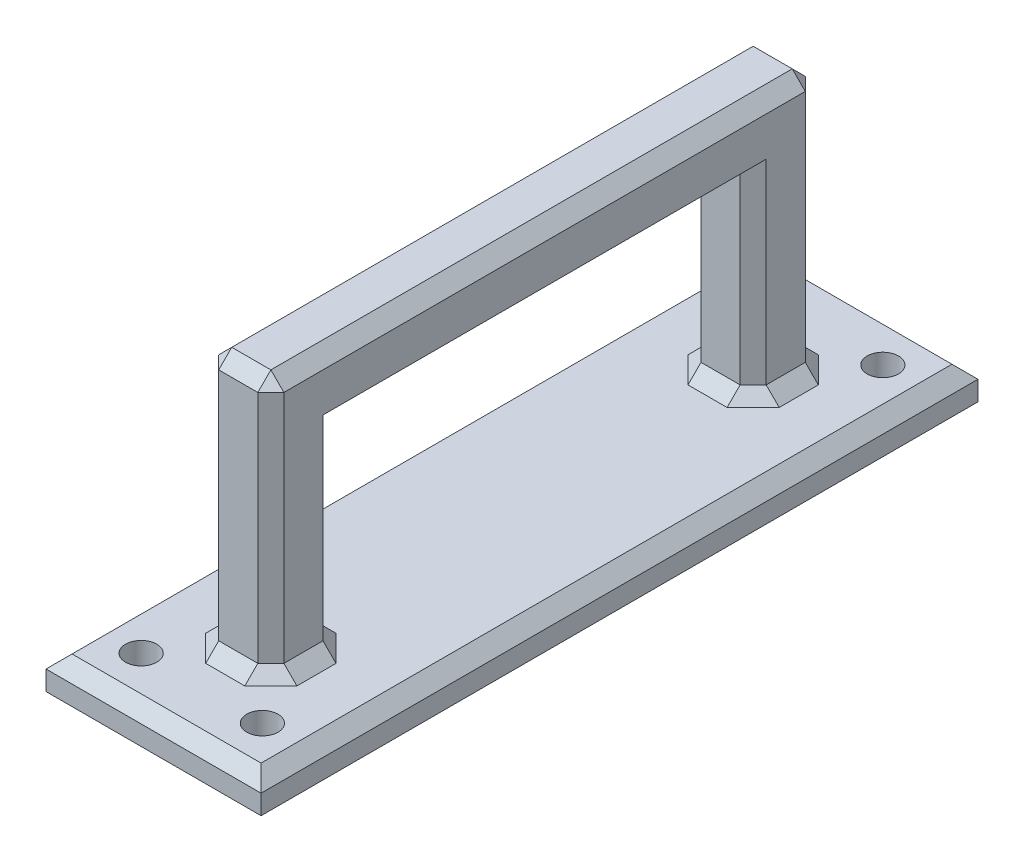
from build123d import *

# Parameters (mm, degrees)
SKETCH1_W           = 41.91
SKETCH1_H           = 139.7
BOSS_EXTRUDE1_DEPTH = 6.35
SKETCH2_R           = 3.048
CUT_EXTRUDE1_DEPTH  = 146.989248234
SKETCH3_W           = 12.7
SKETCH3_H           = 12.7
BOSS_EXTRUDE2_DEPTH = 50.8
BOSS_EXTRUDE3_REACH = 133.265
SKETCH4_W           = 12.7
SKETCH4_H           = 12.7
CHAMFER1_SIZE       = 2.54


with BuildPart() as part:
    # Sketch1 → Boss-Extrude1 (new body)
    with BuildSketch(Plane(origin=(0, 0, 0), x_dir=(1, 0, 0), z_dir=(0, 1, 0))):
        with Locations((-20.955, 69.85)):
            Rectangle(SKETCH1_W, SKETCH1_H)
    extrude(amount=BOSS_EXTRUDE1_DEPTH)

    # Sketch2 → Cut-Extrude1 (cut, through all)
    with BuildSketch(Plane(origin=(0, 6.35, 0), x_dir=(1, 0, 0), z_dir=(0, 1, 0))):
        with Locations(Location((-32.766, 130.302, 0), (0, 0, 270))):
            Circle(SKETCH2_R)
        with Locations(Location((-9.144, 130.302, 0), (0, 0, 270))):
            Circle(SKETCH2_R)
        with Locations(Location((-9.144, 9.398, 0), (0, 0, 270))):
            Circle(SKETCH2_R)
        with Locations(Location((-32.766, 9.398, 0), (0, 0, 270))):
            Circle(SKETCH2_R)
    extrude(amount=-CUT_EXTRUDE1_DEPTH, mode=Mode.SUBTRACT)

    # Sketch3 → Boss-Extrude2 (add)
    with BuildSketch(Plane(origin=(0, 6.35, 0), x_dir=(1, 0, 0), z_dir=(0, 1, 0))):
        with Locations((-20.955, 116.84)):
            Rectangle(SKETCH3_W, SKETCH3_H)
        with Locations((-20.955, 22.86)):
            Rectangle(SKETCH3_W, SKETCH3_H)
    extrude(amount=BOSS_EXTRUDE2_DEPTH)

    # Sketch4 → Boss-Extrude3 (add, up to next)
    with BuildSketch(Plane.XY.offset(-110.49), mode=Mode.PRIVATE) as boss_extrude3_sk1:
        with Locations((-20.955, 50.8)):
            Rectangle(SKETCH4_W, SKETCH4_H)
    boss_extrude3_tool1 = extrude(boss_extrude3_sk1.sketch, amount=BOSS_EXTRUDE3_REACH, mode=Mode.PRIVATE) - part.part
    add(boss_extrude3_tool1.solids().sort_by_distance((-20.955, 50.8, -110.49))[0])

    # Chamfer1
    chamfer1_edges = [part.edges().sort_by_distance(p)[0] for p in [
        (-41.91, 6.35, -69.85),
        (-20.955, 6.35, 0),
        (-27.305, 6.35, -116.84),
        (-27.305, 31.75, -123.19),
        (-20.955, 6.35, -110.49),
        (-14.605, 6.35, -116.84),
        (-20.955, 6.35, -123.19),
        (-14.605, 31.75, -123.19),
        (-27.305, 57.15, -69.85),
        (-14.605, 57.15, -69.85),
        (-20.955, 57.15, -123.19),
        (-27.305, 6.35, -22.86),
        (-20.955, 6.35, -16.51),
        (-27.305, 31.75, -16.51),
        (-14.605, 6.35, -22.86),
        (-14.605, 31.75, -16.51),
        (-20.955, 6.35, -29.21),
        (-20.955, 57.15, -16.51),
        (0, 6.35, -69.85),
        (-14.605, 25.4, -29.21),
        (-14.605, 25.4, -110.49),
        (-27.305, 25.4, -110.49),
        (-27.305, 25.4, -29.21),
        (-27.305, 44.45, -69.85),
        (-14.605, 44.45, -69.85),
        (-20.955, 6.35, -139.7),
    ]]
    chamfer(chamfer1_edges, length=CHAMFER1_SIZE)


solid = part.part
